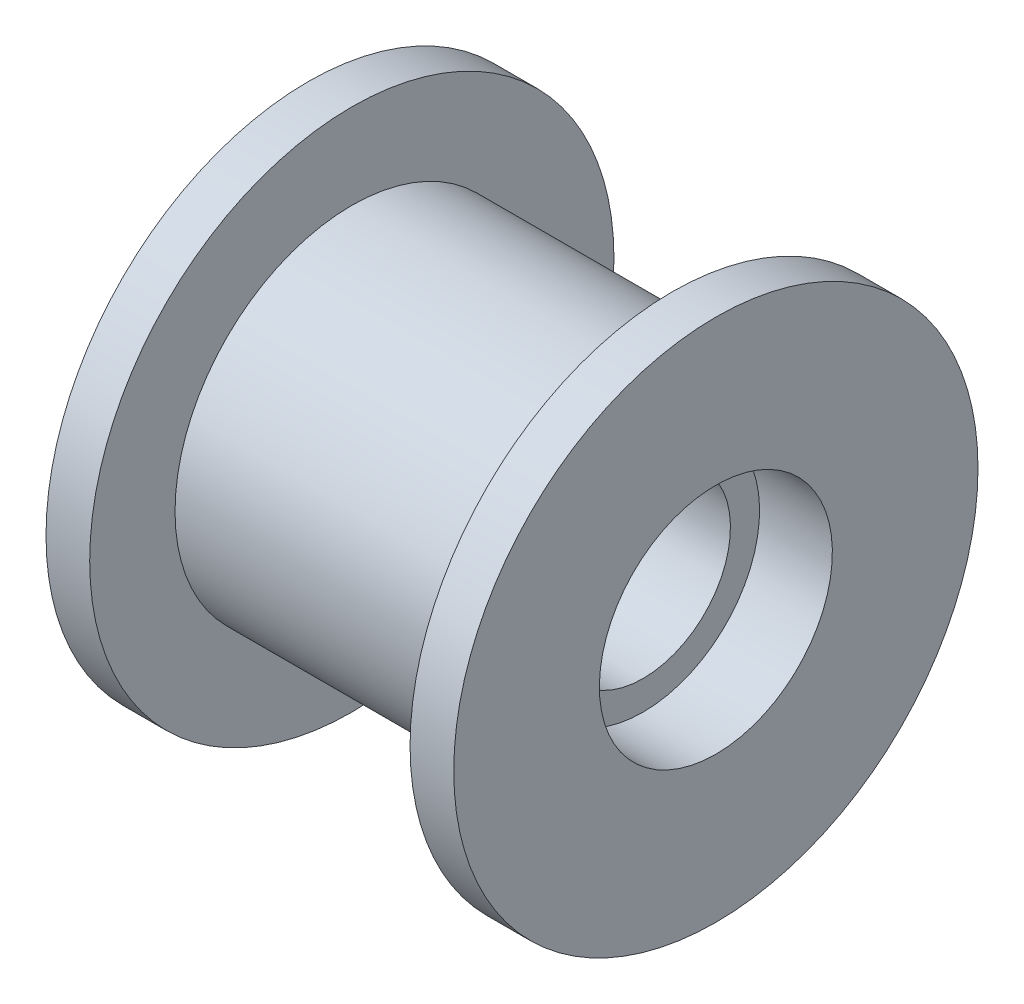
from build123d import *

# Parameters (mm, degrees)
CUT_EXTRUDE2_DEPTH      = 19.920887928
CUT_EXTRUDE2_DEPTH_BACK = 19.920887928
SKETCH3_R               = 3
SKETCH2_R               = 4
CUT_EXTRUDE1_DEPTH      = 2.5
CUT_EXTRUDE4_START      = 2.5
SKETCH4_R               = 4
CUT_EXTRUDE4_DEPTH      = 2.5


with BuildPart() as part:
    # Sketch1 → Revolve1 (revolve)
    with BuildSketch(Plane.XY):
        Polygon((-7, 0), (-7, 9), (-5.5, 9), (-5.5, 6.07), (5.5, 6.07), (5.5, 9), (7, 9), (7, 0), align=None)
    revolve(axis=Axis((7, 0, 0), (-1, 0, 0)))

    # Sketch3 → Cut-Extrude2 (cut, two sides: drawn at the far end of the back side and taken through both)
    with BuildSketch(Plane(origin=(7, 0, 0), x_dir=(0, 0, -1), z_dir=(1, 0, 0)).offset(-CUT_EXTRUDE2_DEPTH_BACK)):
        with Locations(Location((0, 0, 0), (0, 0, 90))):
            Circle(SKETCH3_R)
    extrude(amount=CUT_EXTRUDE2_DEPTH + CUT_EXTRUDE2_DEPTH_BACK, mode=Mode.SUBTRACT)

    # Sketch2 → Cut-Extrude1 (cut)
    with BuildSketch(Plane(origin=(-7, 0, 18.209055513), x_dir=(0, 0, 1), z_dir=(-1, 0, 0))):
        with Locations(Location((-18.209055513, 0, 0), (0, 0, 270))):
            Circle(SKETCH2_R)
    extrude(amount=-CUT_EXTRUDE1_DEPTH, mode=Mode.SUBTRACT)

    # Sketch4 → Cut-Extrude4 (cut)
    with BuildSketch(Plane(origin=(7, 0, 11.209055513), x_dir=(0, 0, 1), z_dir=(-1, 0, 0)).offset(CUT_EXTRUDE4_START)):
        with Locations(Location((-11.209055513, 0, 0), (0, 0, 270))):
            Circle(SKETCH4_R)
    extrude(amount=-CUT_EXTRUDE4_DEPTH, mode=Mode.SUBTRACT)


solid = part.part
